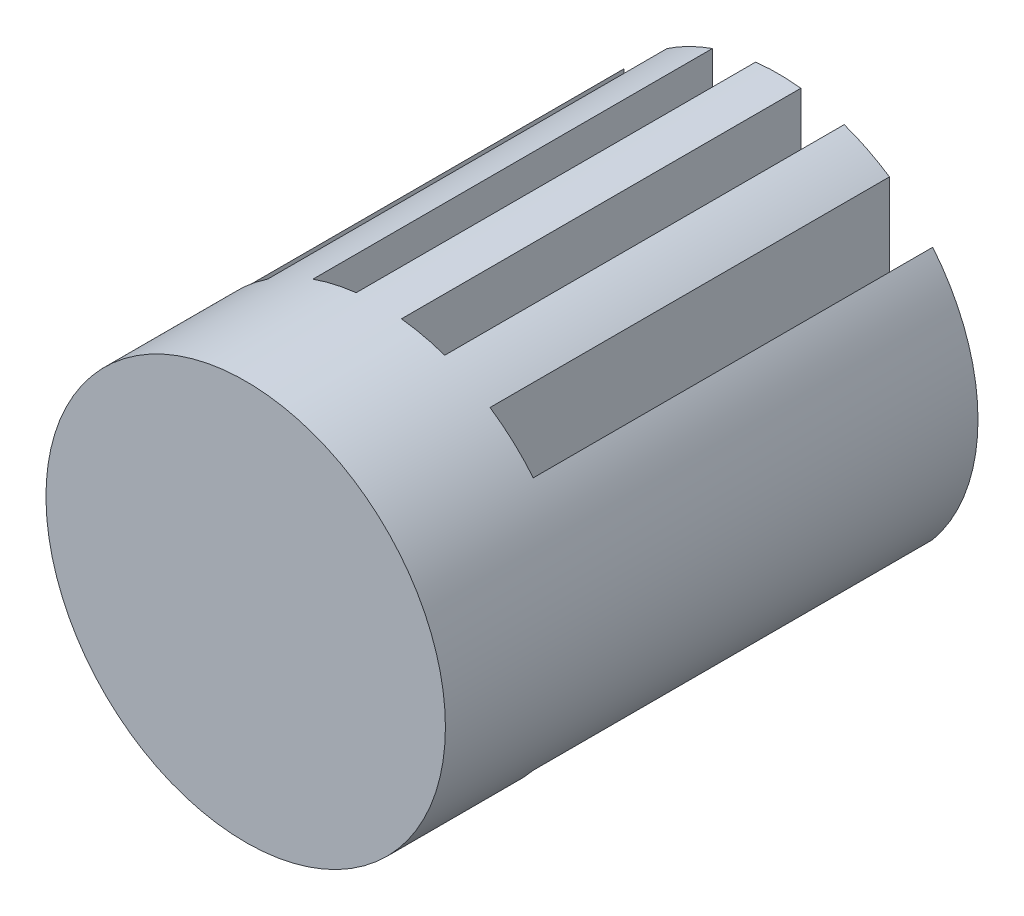
from build123d import *

# Parameters (mm, degrees)
ESQUISSE1_R             = 19.05
BOSS_EXTRU_1_DEPTH      = 50.8
ESQUISSE6_W             = 4.1275
ESQUISSE6_H             = 38.1
ENL_V_MAT_EXTRU_1_DEPTH = 38.1
ESQUISSE7_W             = 4.1275
ESQUISSE7_H             = 38.1
ENL_V_MAT_EXTRU_2_DEPTH = 38.1


with BuildPart() as part:
    # Esquisse1 → Boss.-Extru.1 (new body)
    with BuildSketch(Plane.XY):
        Circle(ESQUISSE1_R)
    extrude(amount=BOSS_EXTRU_1_DEPTH)

    # Esquisse6 → Enlèv. mat.-Extru.1 (cut)
    with BuildSketch(Plane(origin=(0, 0, 0), x_dir=(-1, 0, 0), z_dir=(0, 0, -1))):
        with Locations((4.22275, 0)):
            Rectangle(ESQUISSE6_W, ESQUISSE6_H)
    extrude(amount=-ENL_V_MAT_EXTRU_1_DEPTH, mode=Mode.SUBTRACT)

    # Esquisse7 → Enlèv. mat.-Extru.2 (cut)
    with BuildSketch(Plane(origin=(0, 0, 0), x_dir=(-1, 0, 0), z_dir=(0, 0, -1))):
        with Locations((-4.22275, 0)):
            Rectangle(ESQUISSE7_W, ESQUISSE7_H)
        with Locations((-12.66825, 0)):
            Rectangle(ESQUISSE7_W, ESQUISSE7_H)
        with Locations((12.66825, 0)):
            Rectangle(ESQUISSE7_W, ESQUISSE7_H)
    extrude(amount=-ENL_V_MAT_EXTRU_2_DEPTH, mode=Mode.SUBTRACT)


solid = part.part
